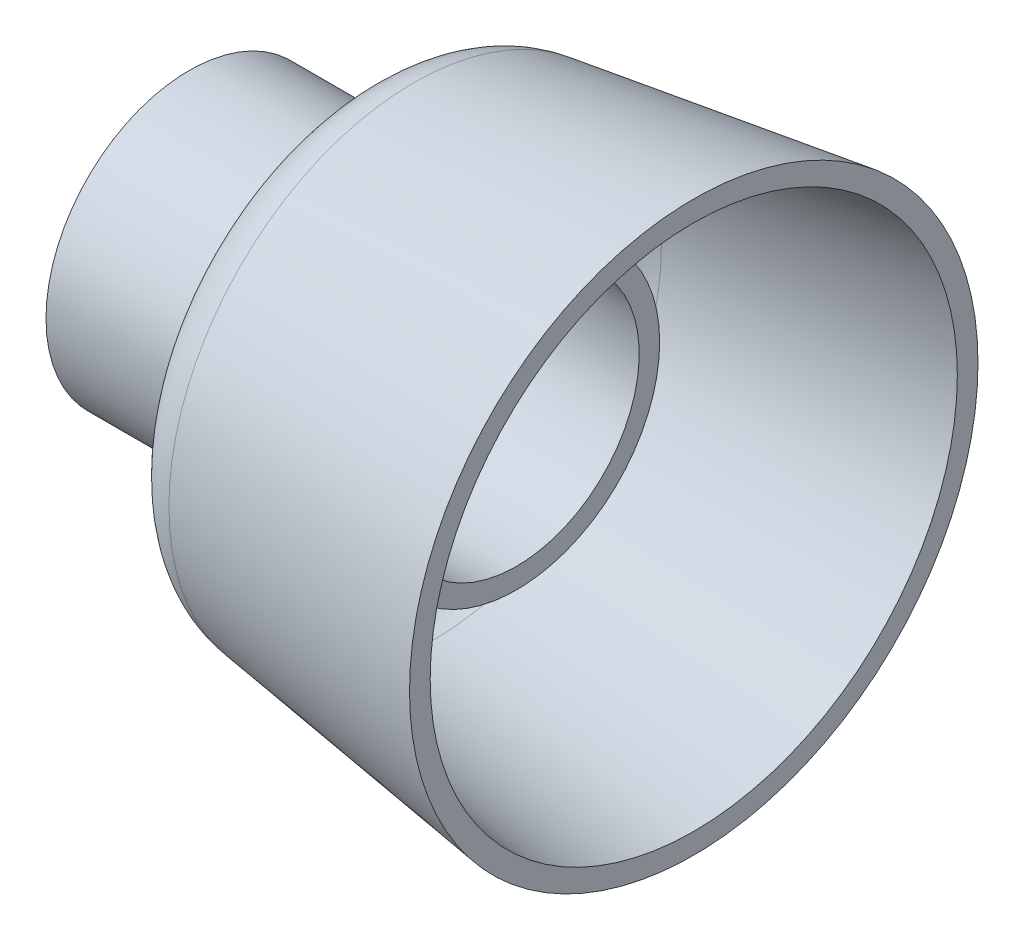
from build123d import *

# Parameters (mm, degrees)
FILLET1_R = 4.7625


with BuildPart() as part:
    # Sketch1 → Revolve1 (revolve)
    with BuildSketch(Plane.XY, mode=Mode.PRIVATE) as revolve1_sk:
        Polygon((0, 11.1125), (12.7, 11.1125), (14.007022457, 18.524992696), (39.159831403, 22.059989461), (39.159831403, 20.456888189), (15.594522457, 17.145), (14.530829946, 11.1125), (25.4, 11.1125), (25.4, 9.525), (0, 9.525), align=None)
    revolve(revolve1_sk.sketch.rotate(Axis((0, 0, 0), (1, 0, 0)), 90), axis=Axis((0, 0, 0), (1, 0, 0)))

    # Fillet1
    fillet1_edges = [part.edges().sort_by_distance(p)[0] for p in [
        (14.007022457, 0, -18.524992696),
        (15.594522457, 0, -17.145),
    ]]
    fillet(fillet1_edges, radius=FILLET1_R)


solid = part.part
